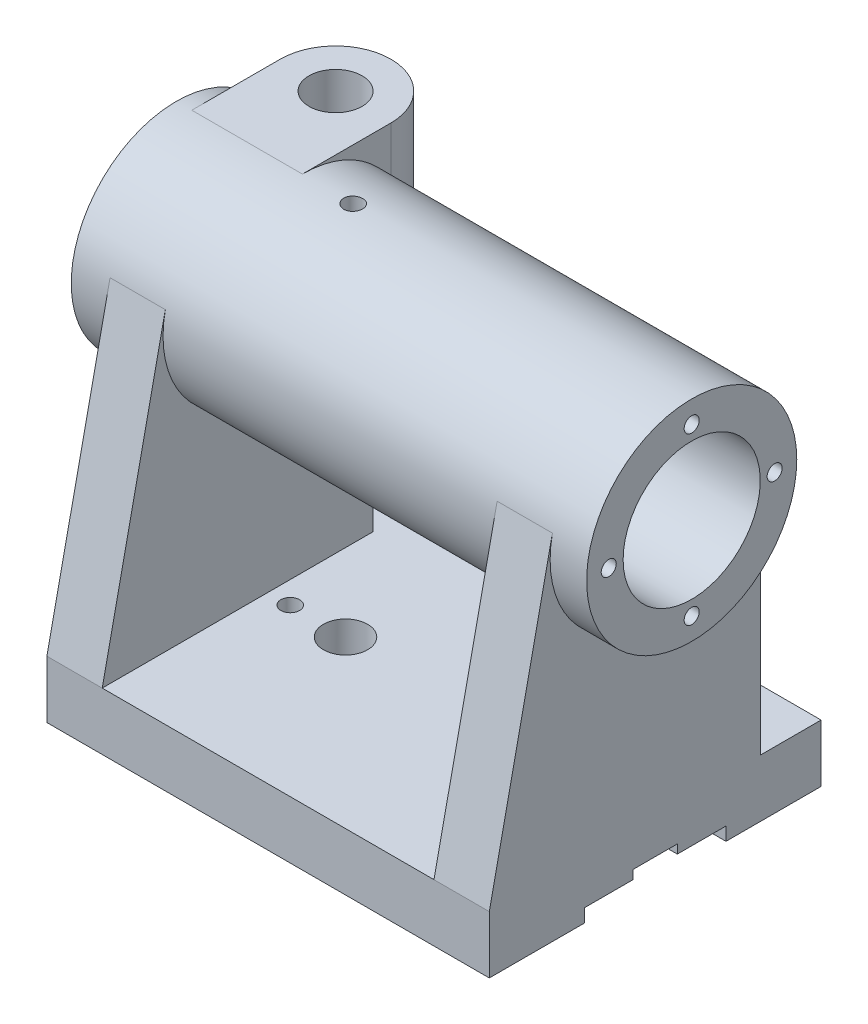
from build123d import *

# Parameters (mm, degrees)
SKETCH_2_R                   = 47.5
EXTRUDE_1_DEPTH              = 233
EXTRUDE_2_DEPTH              = 47.5
SKETCH_6_W                   = 200
SKETCH_6_H                   = 150
EXTRUDE_3_DEPTH              = 26
CUT_EXTRUDE_2_DEPTH          = 274.856257996
CUT_EXTRUDE_2_DEPTH_BACK     = 274.856257996
SKETCH_7_W                   = 64
SKETCH_7_H                   = 12
SKETCH_9_R                   = 10
CUT_EXTRUDE_3_DEPTH          = 20
SKETCH_11_W                  = 4.25
SKETCH_11_H                  = 20.001
HOLE_WIZARD_M10_1_AT_2_COUNT = 2
HOLE_WIZARD_M10_1_AT_2_PITCH = 130
CUT_EXTRUDE_START            = -60
SKETCH_12_W                  = 20
SKETCH_12_H                  = 8
CUT_EXTRUDE_4_DEPTH          = 60
EXTRUDE_6_DEPTH              = 25
RIB_8_REACH                  = 275.856
SKETCH_18_WALL_W             = 686.623983736
SKETCH_18_WALL_H             = 25
EXTRUDE_START                = -25
EXTRUDE_7_DEPTH              = 25
SKETCH_20_W                  = 25
SKETCH_20_H                  = 47.5
EXTRUDE_10_DEPTH             = 50
CUT_EXTRUDE_1_DEPTH          = 288.078386589
CUT_EXTRUDE_1_DEPTH_BACK     = 288.078386589
SKETCH_3_R                   = 31
HOLE_WIZARD_M8_1_AT_2_COUNT  = 2
HOLE_WIZARD_M8_1_AT_2_PITCH  = 53.033008589
HOLE_WIZARD_M8_1_AT_3_COUNT  = 2
HOLE_WIZARD_M8_1_AT_3_PITCH  = 75
HOLE_WIZARD_M8_1_AT_4_COUNT  = 2
HOLE_WIZARD_M8_1_AT_4_PITCH  = 53.033008589
SKETCH_27_W                  = 4.25
SKETCH_27_H                  = 47.5
SKETCH_16_R                  = 12
CUT_EXTRUDE_6_DEPTH          = 85


with BuildPart() as part:
    # 草图2 → 凸台-拉伸1 (new body)
    with BuildSketch(Plane(origin=(0, 0, 0), x_dir=(0, 0, -1), z_dir=(1, 0, 0))):
        Circle(SKETCH_2_R)
    extrude(amount=EXTRUDE_1_DEPTH)

    # 草图4 → 凸台-拉伸2 (add, symmetric)
    with BuildSketch(Plane(origin=(0, 0, 0), x_dir=(1, 0, 0), z_dir=(0, 1, 0))):
        with BuildLine():
            Line((7, 40), (7, 0))
            Line((7, 0), (57, 0))
            Line((57, 0), (57, 40))
            ThreePointArc((57, 40), (32, 65), (7, 40))
        make_face()
    extrude(amount=EXTRUDE_2_DEPTH, both=True)



with BuildPart() as body_2:
    # 草图6 → 凸台-拉伸3 (new body)
    with BuildSketch(Plane(origin=(0, -150, 0), x_dir=(1, 0, 0), z_dir=(0, 1, 0))):
        with Locations((116.5, 0)):
            Rectangle(SKETCH_6_W, SKETCH_6_H)
    extrude(amount=EXTRUDE_3_DEPTH)

    # 草图7 → 切除-拉伸2 (cut, two sides: drawn at the far end of the back side and taken through both)
    with BuildSketch(Plane.ZY.offset(-16.5).offset(-CUT_EXTRUDE_2_DEPTH_BACK)):
        with Locations((0, -150)):
            Rectangle(SKETCH_7_W, SKETCH_7_H)
    extrude(amount=CUT_EXTRUDE_2_DEPTH + CUT_EXTRUDE_2_DEPTH_BACK, mode=Mode.SUBTRACT)

    # 草图9 → 切除-拉伸3 (cut)
    with BuildSketch(Plane(origin=(0, -124, 0), x_dir=(1, 0, 0), z_dir=(0, 1, 0))):
        with Locations(Location((76.5, 0, 0), (0, 0, 270))):
            Circle(SKETCH_9_R)
        with Locations(Location((156.5, 0, 0), (0, 0, 270))):
            Circle(SKETCH_9_R)
    extrude(amount=-CUT_EXTRUDE_3_DEPTH, mode=Mode.SUBTRACT)

    # 草图11 → Hole Wizard M10 _1 (revolve, cut)
    with BuildSketch(Plane(origin=(181.5, -124, 0), x_dir=(0, 0, 1), z_dir=(1, 0, 0))):
        with Locations((2.125, 10.0005)):
            Rectangle(SKETCH_11_W, SKETCH_11_H)
    hole_wizard_m10_1 = revolve(axis=Axis((181.5, -117.65, 0), (0, -1, 0)), mode=Mode.SUBTRACT)

    # Hole Wizard M10 _1 at 2: Hole Wizard M10 _1 ×2
    with Locations(*[(-i * HOLE_WIZARD_M10_1_AT_2_PITCH, 0, 0) for i in range(1, HOLE_WIZARD_M10_1_AT_2_COUNT)]):
        add(hole_wizard_m10_1, mode=Mode.SUBTRACT)

    # 草图12 → 切除-拉伸4 (cut)
    with BuildSketch(Plane.ZY.offset(-16.5).offset(CUT_EXTRUDE_START)):
        with Locations((0, -144)):
            Rectangle(SKETCH_12_W, SKETCH_12_H)
    cut_extrude_4 = extrude(amount=CUT_EXTRUDE_4_DEPTH, mode=Mode.SUBTRACT)

    # 镜向1: 切除-拉伸4 across plane
    add(cut_extrude_4.mirror(Plane.ZY.offset(-116.5)), mode=Mode.SUBTRACT)


with BuildPart() as part_1:
    add(part.part)

    add(body_2.part)  # 凸台-拉伸6 merges body 2
    # 草图13 → 凸台-拉伸6 (add)
    with BuildSketch(Plane.ZY.offset(-16.5)):
        with BuildLine():
            Line((-47.5, -124), (-35, -124))
            Line((-35, -124), (-35, -82.5))
            ThreePointArc((-35, -82.5), (-24.748737342, -57.751262658), (0, -47.5))
            Line((0, -47.5), (-47.5, -47.5))
            Line((-47.5, -47.5), (-47.5, -124))
        make_face()
    extrude(amount=-EXTRUDE_6_DEPTH)

    # 草图18 wall → 筋8 (add, up to next)
    with BuildSketch(Plane(origin=(16.5, -57.048519027, 60.728115209), x_dir=(0, 0.978025903544, -0.208483409404), z_dir=(0, -0.208483409404, -0.978025903544)), mode=Mode.PRIVATE) as rib_8_sk1:
        with Locations((0, 12.5)):
            Rectangle(SKETCH_18_WALL_W, SKETCH_18_WALL_H)
    rib_8_tool1 = extrude(rib_8_sk1.sketch, amount=RIB_8_REACH, mode=Mode.PRIVATE) - part_1.part
    add(rib_8_tool1.solids().sort_by_distance((16.5, -57.048519027, 60.728115209))[0])

    # 草图19 → 凸台-拉伸7 (add)
    with BuildSketch(Plane(origin=(216.5, 0, 0), x_dir=(0, 0, -1), z_dir=(1, 0, 0)).offset(EXTRUDE_START)):
        with BuildLine():
            Line((47.5, -47.5), (0, -47.5))
            ThreePointArc((0, -47.5), (-36.92316815, -29.881928548), (-46.456230418, 9.902961947))
            Line((-46.456230418, 9.902961947), (-75, -124))
            Line((-75, -124), (47.5, -124))
            Line((47.5, -124), (47.5, -47.5))
        make_face()
    extrude(amount=EXTRUDE_7_DEPTH)

    # 草图20 → 凸台-拉伸10 (add)
    with BuildSketch(Plane(origin=(0, -47.5, 0), x_dir=(1, 0, 0), z_dir=(0, 1, 0))):
        with Locations((204, 23.75)):
            Rectangle(SKETCH_20_W, SKETCH_20_H)
    extrude(amount=EXTRUDE_10_DEPTH)

    # 草图3 → 切除-拉伸1 (cut, two sides: drawn at the far end of the back side and taken through both)
    with BuildSketch(Plane.ZY.offset(-CUT_EXTRUDE_1_DEPTH_BACK)):
        Circle(SKETCH_3_R)
    extrude(amount=CUT_EXTRUDE_1_DEPTH + CUT_EXTRUDE_1_DEPTH_BACK, mode=Mode.SUBTRACT)

    # 草图25 → M8 螺纹孔1 (revolve, cut)
    with BuildSketch(Plane(origin=(0, 0, -37.5), x_dir=(0, 0, 1), z_dir=(0, 1, 0))):
        Polygon((0, 0), (0, 23), (3.4, 20.957073895), (3.4, 0), align=None)
    hole_wizard_m8_1 = revolve(axis=Axis((-6.35, 0, -37.5), (1, 0, 0)), mode=Mode.SUBTRACT)

    # M8 螺纹孔1 at 2: M8 螺纹孔1 ×2
    with Locations(*[Vector(0, 0.7071067811865476, 0.7071067811865476) * (i * HOLE_WIZARD_M8_1_AT_2_PITCH) for i in range(1, HOLE_WIZARD_M8_1_AT_2_COUNT)]):
        add(hole_wizard_m8_1, mode=Mode.SUBTRACT)

    # M8 螺纹孔1 at 3: M8 螺纹孔1 ×2
    with Locations(*[(0, 0, i * HOLE_WIZARD_M8_1_AT_3_PITCH) for i in range(1, HOLE_WIZARD_M8_1_AT_3_COUNT)]):
        add(hole_wizard_m8_1, mode=Mode.SUBTRACT)

    # M8 螺纹孔1 at 4: M8 螺纹孔1 ×2
    with Locations(*[Vector(0, -0.7071067811865476, 0.7071067811865476) * (i * HOLE_WIZARD_M8_1_AT_4_PITCH) for i in range(1, HOLE_WIZARD_M8_1_AT_4_COUNT)]):
        add(hole_wizard_m8_1, mode=Mode.SUBTRACT)

    # 镜向6: M8 螺纹孔1 across plane
    add(hole_wizard_m8_1.mirror(Plane.ZY.offset(-116.5)), mode=Mode.SUBTRACT)

    # 镜向6 copy 1 sketch → 镜向6 copy 1 (revolve, cut)
    with BuildSketch(Plane(origin=(233, 37.5, 0), x_dir=(0, 0, 1), z_dir=(0, 1, 0))):
        Polygon((0, 0), (0, -23), (3.4, -20.957073895), (3.4, 0), align=None)
    revolve(axis=Axis((239.35, 37.5, 0), (1, 0, 0)), mode=Mode.SUBTRACT)

    # 镜向6 copy 2 sketch → 镜向6 copy 2 (revolve, cut)
    with BuildSketch(Plane(origin=(233, 0, 37.5), x_dir=(0, 0, 1), z_dir=(0, 1, 0))):
        Polygon((0, 0), (0, -23), (3.4, -20.957073895), (3.4, 0), align=None)
    revolve(axis=Axis((239.35, 0, 37.5), (1, 0, 0)), mode=Mode.SUBTRACT)

    # 镜向6 copy 3 sketch → 镜向6 copy 3 (revolve, cut)
    with BuildSketch(Plane(origin=(233, -37.5, 0), x_dir=(0, 0, 1), z_dir=(0, 1, 0))):
        Polygon((0, 0), (0, -23), (3.4, -20.957073895), (3.4, 0), align=None)
    revolve(axis=Axis((239.35, -37.5, 0), (1, 0, 0)), mode=Mode.SUBTRACT)

    # 草图27 → Hole Wizard M10 _1 2 (revolve, cut)
    with BuildSketch(Plane(origin=(80, 0, 0), x_dir=(0, 0, -1), z_dir=(1, 0, 0))):
        with Locations((2.125, 23.75)):
            Rectangle(SKETCH_27_W, SKETCH_27_H)
    revolve(axis=Axis((80, -6.35, 0), (0, 1, 0)), mode=Mode.SUBTRACT)

    # 草图16 → 切除-拉伸6 (cut)
    with BuildSketch(Plane(origin=(0, 47.5, 0), x_dir=(1, 0, 0), z_dir=(0, 1, 0))):
        with Locations(Location((32, 40, 0), (0, 0, 270))):
            Circle(SKETCH_16_R)
    extrude(amount=-CUT_EXTRUDE_6_DEPTH, mode=Mode.SUBTRACT)


solid = part_1.part
